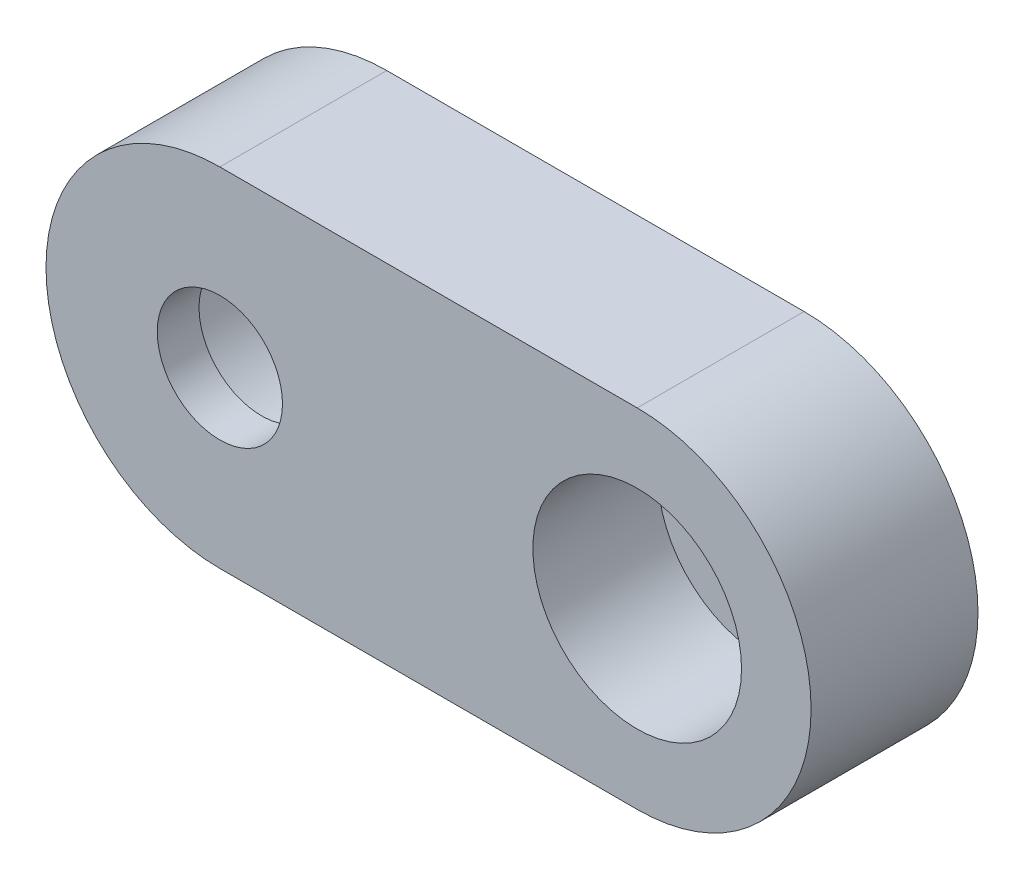
from build123d import *

# Parameters (mm, degrees)
EXTRUDE_1_DEPTH           = 12
HOLE_WIZARD_1_D           = 9
HOLE_WIZARD_1_DEPTH       = 19.75
HOLE_WIZARD_1_CBORE_D     = 15
HOLE_WIZARD_1_CBORE_DEPTH = 9
HOLE_WIZARD_1_TIP         = 2.703872786
HOLE_WIZARD_2_D           = 9
HOLE_WIZARD_2_DEPTH       = 19.75
HOLE_WIZARD_2_CBORE_D     = 15
HOLE_WIZARD_2_CBORE_DEPTH = 9
HOLE_WIZARD_2_TIP         = 2.703872786


with BuildPart() as part:
    # 草图1 → 凸台-拉伸1 (new body)
    with BuildSketch(Plane.XY):
        with BuildLine():
            Line((-15, 12.5), (15, 12.5))
            ThreePointArc((15, 12.5), (27.5, 0), (15, -12.5))
            Line((15, -12.5), (-15, -12.5))
            ThreePointArc((-15, -12.5), (-27.5, 0), (-15, 12.5))
        make_face()
    extrude(amount=EXTRUDE_1_DEPTH)

    # 打孔尺寸(%根据)内六角圆柱头螺钉的类型1
    with Locations(Plane(origin=(0, 0, 0), x_dir=(-1, 0, 0), z_dir=(0, 0, -1))):
        with Locations((15, 0)):
            CounterBoreHole(HOLE_WIZARD_1_D / 2, HOLE_WIZARD_1_CBORE_D / 2, HOLE_WIZARD_1_CBORE_DEPTH, depth=HOLE_WIZARD_1_DEPTH)
            with Locations((0, 0, -(HOLE_WIZARD_1_DEPTH + HOLE_WIZARD_1_TIP / 2))):  # 118° drill point
                Cone(0, HOLE_WIZARD_1_D / 2, HOLE_WIZARD_1_TIP, mode=Mode.SUBTRACT)

    # 打孔尺寸(%根据)内六角圆柱头螺钉的类型2
    with Locations(Plane.XY.offset(12)):
        with Locations((15, 0)):
            CounterBoreHole(HOLE_WIZARD_2_D / 2, HOLE_WIZARD_2_CBORE_D / 2, HOLE_WIZARD_2_CBORE_DEPTH, depth=HOLE_WIZARD_2_DEPTH)
            with Locations((0, 0, -(HOLE_WIZARD_2_DEPTH + HOLE_WIZARD_2_TIP / 2))):  # 118° drill point
                Cone(0, HOLE_WIZARD_2_D / 2, HOLE_WIZARD_2_TIP, mode=Mode.SUBTRACT)


solid = part.part
